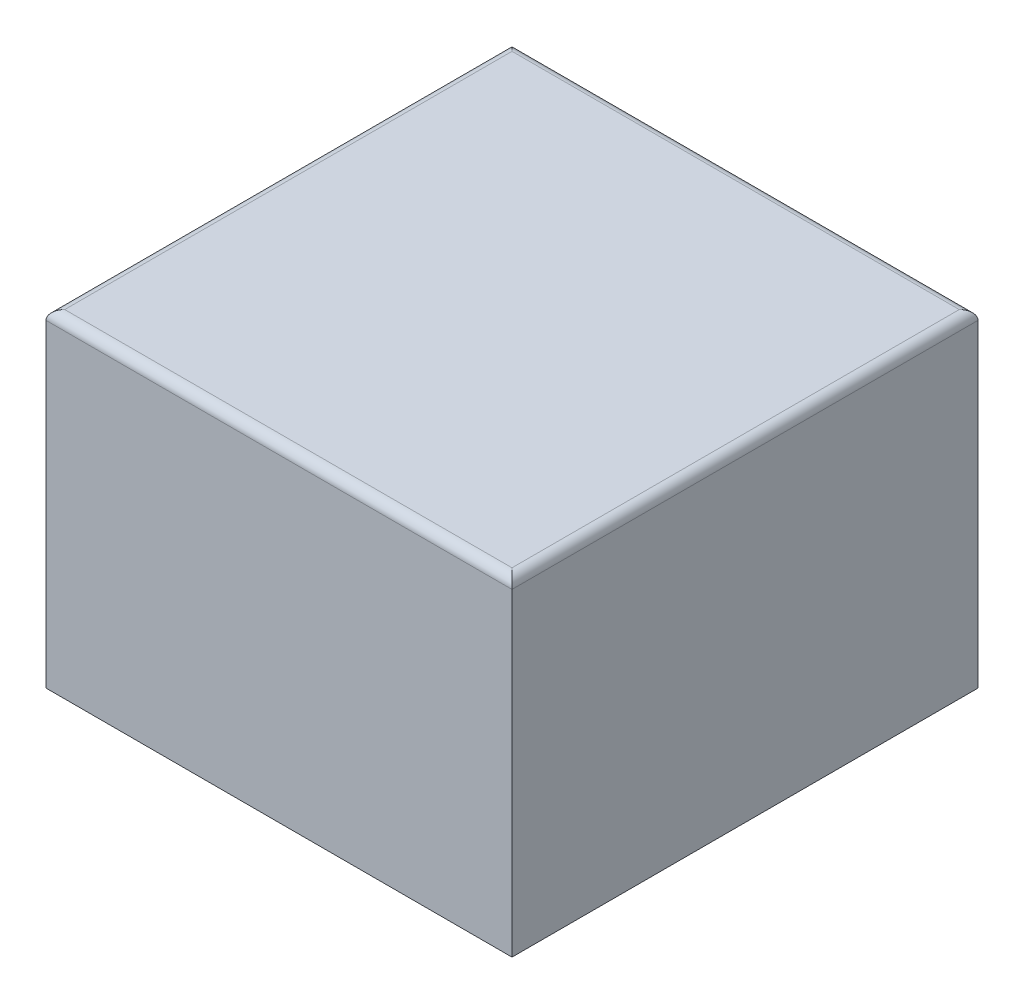
from build123d import *

# Parameters (mm, degrees)
SKETCH1_W           = 9.95
SKETCH1_H           = 9.95
BOSS_EXTRUDE1_DEPTH = 7
FILLET1_R           = 0.2


with BuildPart() as part:
    # Sketch1 → Boss-Extrude1 (new body)
    with BuildSketch(Plane(origin=(0, 0, 0), x_dir=(1, 0, 0), z_dir=(0, 1, 0))):
        Rectangle(SKETCH1_W, SKETCH1_H)
    extrude(amount=BOSS_EXTRUDE1_DEPTH)

    # Fillet1
    fillet1_edges = [part.edges().sort_by_distance(p)[0] for p in [
        (4.975, 7, 0),
        (0, 7, -4.975),
        (-4.975, 7, 0),
        (0, 7, 4.975),
    ]]
    fillet(fillet1_edges, radius=FILLET1_R)


solid = part.part
